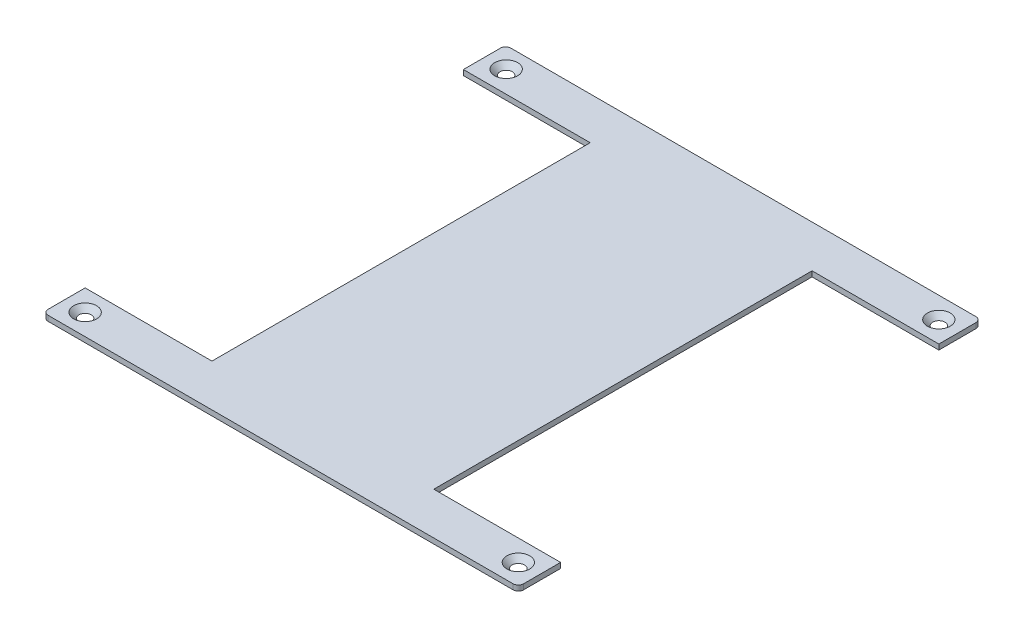
from build123d import *

# Parameters (mm, degrees)
SKETCH1_W                                    = 114.3
SKETCH1_H                                    = 111.252
BOSS_EXTRUDE1_DEPTH                          = 1.27
CSK_FOR_M2_5_COUNTERSUNK_FLAT_HEAD_S_2_COUNT = 2
CSK_FOR_M2_5_COUNTERSUNK_FLAT_HEAD_S_2_PITCH = 104.140077439
CSK_FOR_M2_5_COUNTERSUNK_FLAT_HEAD_S_3_COUNT = 2
CSK_FOR_M2_5_COUNTERSUNK_FLAT_HEAD_S_3_PITCH = 145.225430146
CSK_FOR_M2_5_COUNTERSUNK_FLAT_HEAD_S_4_COUNT = 2
CSK_FOR_M2_5_COUNTERSUNK_FLAT_HEAD_S_4_PITCH = 101.219
FILLET1_R                                    = 1.27
SKETCH9_W                                    = 30.48
SKETCH9_H                                    = 90.932
CUT_EXTRUDE5_DEPTH                           = 5.08


with BuildPart() as part:
    # Sketch1 → Boss-Extrude1 (new body)
    with BuildSketch(Plane(origin=(0, 0, 0), x_dir=(1, 0, 0), z_dir=(0, 1, 0))):
        with Locations((-13.076419672, -24.671311475)):
            Rectangle(SKETCH1_W, SKETCH1_H)
    extrude(amount=BOSS_EXTRUDE1_DEPTH)

    # Sketch3 → CSK for M2.5 Countersunk Flat Head Screw1 (revolve, cut)
    with BuildSketch(Plane(origin=(-65.146419672, 1.27, -26.001688525), x_dir=(0, 0, 1), z_dir=(1, 0, 0))):
        Polygon((0, 0), (0, 1.27), (1.45, 1.27), (1.45, 1.3), (2.75, 0), align=None)
    csk_for_m2_5_countersunk_flat_head_screw = revolve(axis=Axis((-65.146419672, 7.62, -26.001688525), (0, -1, 0)), mode=Mode.SUBTRACT)

    # CSK for M2.5 Countersunk Flat Head S 2: CSK for M2.5 Countersunk Flat Head Screw1 ×2
    with Locations(*[Vector(0.9999992563958324, 0, 0.0012195112882876242) * (i * CSK_FOR_M2_5_COUNTERSUNK_FLAT_HEAD_S_2_PITCH) for i in range(1, CSK_FOR_M2_5_COUNTERSUNK_FLAT_HEAD_S_2_COUNT)]):
        add(csk_for_m2_5_countersunk_flat_head_screw, mode=Mode.SUBTRACT)

    # CSK for M2.5 Countersunk Flat Head S 3: CSK for M2.5 Countersunk Flat Head Screw1 ×2
    with Locations(*[Vector(0.7170920402544414, 0, 0.6969784830277923) * (i * CSK_FOR_M2_5_COUNTERSUNK_FLAT_HEAD_S_3_PITCH) for i in range(1, CSK_FOR_M2_5_COUNTERSUNK_FLAT_HEAD_S_3_COUNT)]):
        add(csk_for_m2_5_countersunk_flat_head_screw, mode=Mode.SUBTRACT)

    # CSK for M2.5 Countersunk Flat Head S 4: CSK for M2.5 Countersunk Flat Head Screw1 ×2
    with Locations(*[(0, 0, i * CSK_FOR_M2_5_COUNTERSUNK_FLAT_HEAD_S_4_PITCH) for i in range(1, CSK_FOR_M2_5_COUNTERSUNK_FLAT_HEAD_S_4_COUNT)]):
        add(csk_for_m2_5_countersunk_flat_head_screw, mode=Mode.SUBTRACT)

    # Fillet1
    fillet1_edges = [part.edges().sort_by_distance(p)[0] for p in [
        (-70.226419672, 0.635, -30.954688525),
        (44.073580328, 0.635, -30.954688525),
        (44.073580328, 0.635, 80.297311475),
        (-70.226419672, 0.635, 80.297311475),
    ]]
    fillet(fillet1_edges, radius=FILLET1_R)

    # Sketch9 → Cut-Extrude5 (cut)
    with BuildSketch(Plane(origin=(0, 1.27, 0), x_dir=(1, 0, 0), z_dir=(0, 1, 0))):
        with Locations((28.833580328, -24.671311475)):
            Rectangle(SKETCH9_W, SKETCH9_H)
        with Locations((-54.986419672, -24.671311475)):
            Rectangle(SKETCH9_W, SKETCH9_H)
    extrude(amount=-CUT_EXTRUDE5_DEPTH, mode=Mode.SUBTRACT)


solid = part.part
